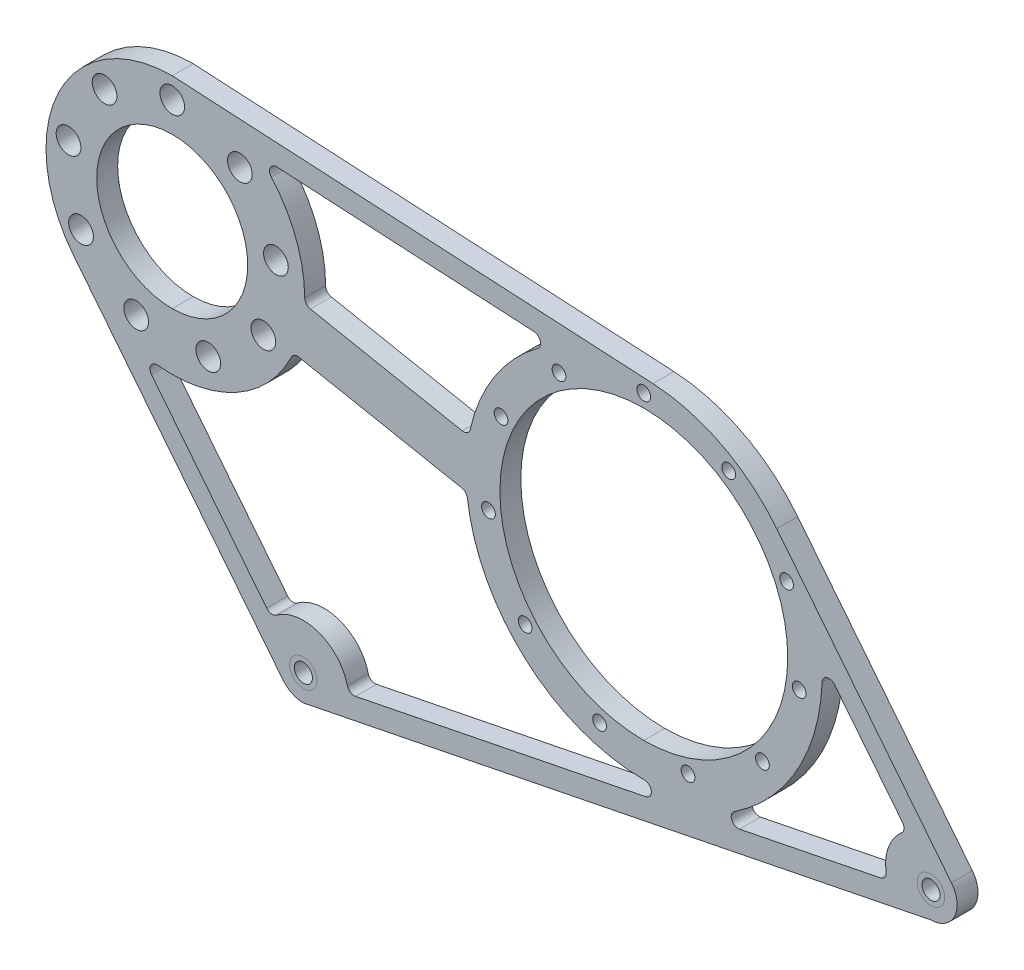
from build123d import *

# Parameters (mm, degrees)
SKETCH1_R               = 3.29946
SKETCH1_R_2             = 27.4955
SKETCH1_R_3             = 52.4256
BOSS_EXTRUDE1_DEPTH     = 7.62
CUT_EXTRUDE1_DEPTH      = 314.319493614
CUT_EXTRUDE1_DEPTH_BACK = 314.319493614
SKETCH2_R               = 4.49961
SKETCH2_R_2             = 2.50063
CUT_EXTRUDE2_DEPTH      = 314.319493614
CUT_EXTRUDE2_DEPTH_BACK = 314.319493614


with BuildPart() as part:
    # Sketch1 → Boss-Extrude1 (new body)
    with BuildSketch(Plane.XY):
        with BuildLine():
            ThreePointArc((40.310707788, -124.394878894), (43.625834707, -127.040890072), (47.760987503, -127.985322704))
            Line((47.760987503, -127.985322704), (276.360987503, -82.143687357))
            ThreePointArc((276.360987503, -82.143687357), (284.941554871, -76.753840153), (283.811267218, -66.684131167))
            Line((283.811267218, -66.684131167), (220.199398147, 13.174615234))
            ThreePointArc((220.199398147, 13.174615234), (200.160512587, 29.620750083), (175.144631834, 36.420602736))
            Line((175.144631834, 36.420602736), (0, 45.974))
            ThreePointArc((0, 45.974), (-41.415538495, 19.959004162), (-35.960016757, -28.644124543))
            Line((-35.960016757, -28.644124543), (40.310707788, -124.394878894))
        make_face()
        with Locations((47.760987503, -118.460322704)):
            Circle(SKETCH1_R, mode=Mode.SUBTRACT)
        with Locations((276.360987503, -72.618687357)):
            Circle(SKETCH1_R, mode=Mode.SUBTRACT)
        Circle(SKETCH1_R_2, mode=Mode.SUBTRACT)
        with Locations((171.77258, -25.4)):
            Circle(SKETCH1_R_3, mode=Mode.SUBTRACT)
    extrude(amount=BOSS_EXTRUDE1_DEPTH)

    # Sketch2 → Cut-Extrude1 (cut, two sides: drawn at the far end of the back side and taken through both)
    with BuildSketch(Plane.XY.offset(7.62).offset(-CUT_EXTRUDE1_DEPTH_BACK)):
        with Locations((0, 38.354)):
            Circle(SKETCH2_R)
        with Locations((171.77258, 31.76905)):
            Circle(SKETCH2_R_2)
        with Locations((24.653475982, 29.380868571)):
            Circle(SKETCH2_R)
        with Locations((37.771316559, 6.660102206)):
            Circle(SKETCH2_R)
        with Locations((33.215538337, -19.177)):
            Circle(SKETCH2_R)
        with Locations((13.117840577, -36.040970778)):
            Circle(SKETCH2_R)
        with Locations((-13.117840577, -36.040970778)):
            Circle(SKETCH2_R)
        with Locations((-33.215538337, -19.177)):
            Circle(SKETCH2_R)
        with Locations((-37.771316559, 6.660102206)):
            Circle(SKETCH2_R)
        with Locations((-24.653475982, 29.380868571)):
            Circle(SKETCH2_R)
        with Locations((202.680501925, 22.693665281)):
            Circle(SKETCH2_R_2)
        with Locations((223.775377024, -1.651118351)):
            Circle(SKETCH2_R_2)
        with Locations((228.359731502, -33.536004105)):
            Circle(SKETCH2_R_2)
        with Locations((214.978065204, -62.837766042)):
            Circle(SKETCH2_R_2)
        with Locations((187.878962629, -80.253301783)):
            Circle(SKETCH2_R_2)
        with Locations((155.666197371, -80.253301783)):
            Circle(SKETCH2_R_2)
        with Locations((128.567094796, -62.837766042)):
            Circle(SKETCH2_R_2)
        with Locations((115.185428498, -33.536004105)):
            Circle(SKETCH2_R_2)
        with Locations((119.769782976, -1.651118351)):
            Circle(SKETCH2_R_2)
        with Locations((140.864658075, 22.693665281)):
            Circle(SKETCH2_R_2)
    extrude(amount=CUT_EXTRUDE1_DEPTH + CUT_EXTRUDE1_DEPTH_BACK, mode=Mode.SUBTRACT)

    # Sketch5 → Cut-Extrude2 (cut, two sides: drawn at the far end of the back side and taken through both)
    with BuildSketch(Plane(origin=(0, 0, 0), x_dir=(-1, 0, 0), z_dir=(0, 0, -1)).offset(-CUT_EXTRUDE2_DEPTH_BACK)):
        with BuildLine():
            Line((-265.98852685, -56.539497078), (-241.245162788, -25.476519923))
            ThreePointArc((-241.245162788, -25.476519923), (-238.464669174, -24.646277907), (-236.720158772, -26.965141853))
            ThreePointArc((-236.720158772, -26.965141853), (-227.620878985, -59.228125128), (-204.753887162, -83.739299465))
            ThreePointArc((-204.753887162, -83.739299465), (-203.801270663, -86.826655842), (-206.649906438, -88.351294098))
            Line((-206.649906438, -88.351294098), (-258.038190746, -78.04629414))
            ThreePointArc((-258.038190746, -78.04629414), (-259.622077281, -77.008967427), (-260.048409115, -75.164249445))
            ThreePointArc((-260.048409115, -75.164249445), (-260.880500131, -66.879818937), (-265.649679181, -60.054930991))
            ThreePointArc((-265.649679181, -60.054930991), (-266.530067918, -58.365742929), (-265.98852685, -56.539497078))
        make_face()
        with BuildLine():
            Line((-131.754965097, 31.155997891), (-38.12708703, 36.26300177))
            ThreePointArc((-38.12708703, 36.26300177), (-35.701196113, 34.830725487), (-36.08930912, 32.040433318))
            ThreePointArc((-36.08930912, 32.040433318), (-45.105625086, 17.161299066), (-48.259972129, 0.05186645))
            ThreePointArc((-48.259972129, 0.05186645), (-48.840291996, -1.561342946), (-50.313400987, -2.438363815))
            Line((-50.313400987, -2.438363815), (-105.593039761, -13.227704597))
            ThreePointArc((-105.593039761, -13.227704597), (-107.469894435, -12.860469717), (-108.558589456, -11.288150386))
            ThreePointArc((-108.558589456, -11.288150386), (-117.439212577, 9.856745234), (-133.131943584, 26.581286223))
            ThreePointArc((-133.131943584, 26.581286223), (-134.048834262, 29.351858), (-131.754965097, 31.155997891))
        make_face()
        with BuildLine():
            Line((-172.497020686, -95.200043594), (-66.759785208, -116.403752218))
            ThreePointArc((-66.759785208, -116.403752218), (-64.898408853, -116.057311266), (-63.793790983, -114.519597825))
            ThreePointArc((-63.793790983, -114.519597825), (-53.348385706, -102.924522715), (-37.910600393, -105.210795401))
            ThreePointArc((-37.910600393, -105.210795401), (-36.067318036, -105.691160666), (-34.408414964, -104.754954902))
            Line((-34.408414964, -104.754954902), (7.552696475, -52.076707806))
            ThreePointArc((7.552696475, -52.076707806), (7.7901592, -49.267572092), (5.287657457, -47.969451515))
            ThreePointArc((5.287657457, -47.969451515), (-23.30510003, -42.259909046), (-43.390999871, -21.124600118))
            ThreePointArc((-43.390999871, -21.124600118), (-44.541450027, -19.963260096), (-46.161306381, -19.743461099))
            Line((-46.161306381, -19.743461099), (-105.477050266, -31.320558719))
            ThreePointArc((-105.477050266, -31.320558719), (-106.846053421, -32.079030552), (-107.510559814, -33.496027522))
            ThreePointArc((-107.510559814, -33.496027522), (-129.012430096, -74.048972037), (-171.989119852, -90.16963803))
            ThreePointArc((-171.989119852, -90.16963803), (-174.524763167, -92.454466996), (-172.497020686, -95.200043594))
        make_face()
    extrude(amount=CUT_EXTRUDE2_DEPTH + CUT_EXTRUDE2_DEPTH_BACK, mode=Mode.SUBTRACT)


solid = part.part
